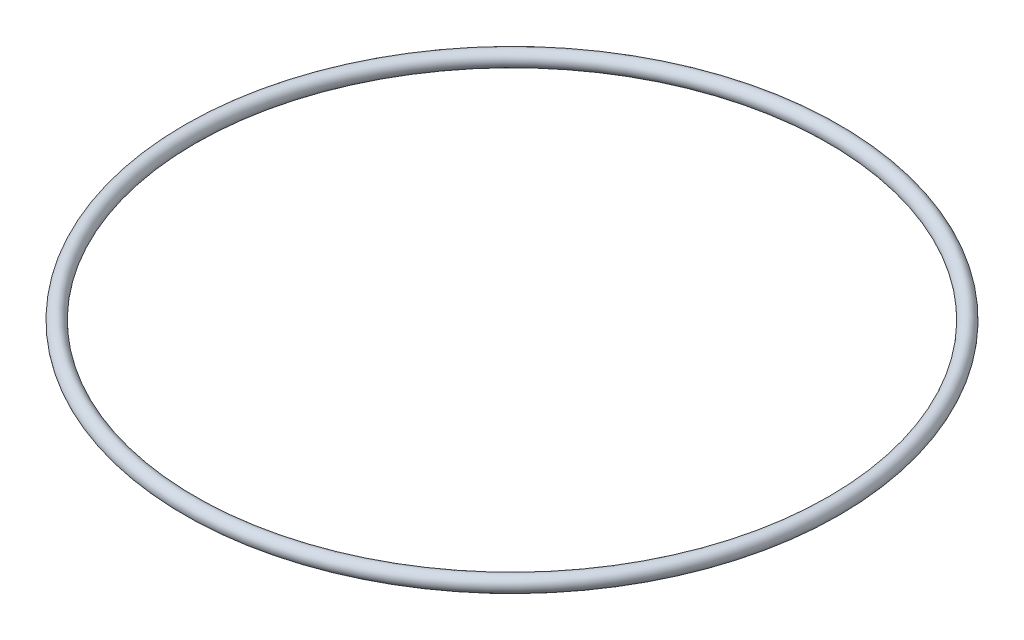
from build123d import *

# Parameters (mm, degrees)
SKETCH2_R = 1.3081


with BuildPart() as part:
    # Sketch2 → Revolve1 (revolve)
    with BuildSketch(Plane.XY):
        with Locations((-55.7149, 0)):
            Circle(SKETCH2_R)
    revolve(axis=Axis((0, 55.443723022, 0), (0, -1, 0)))


solid = part.part
